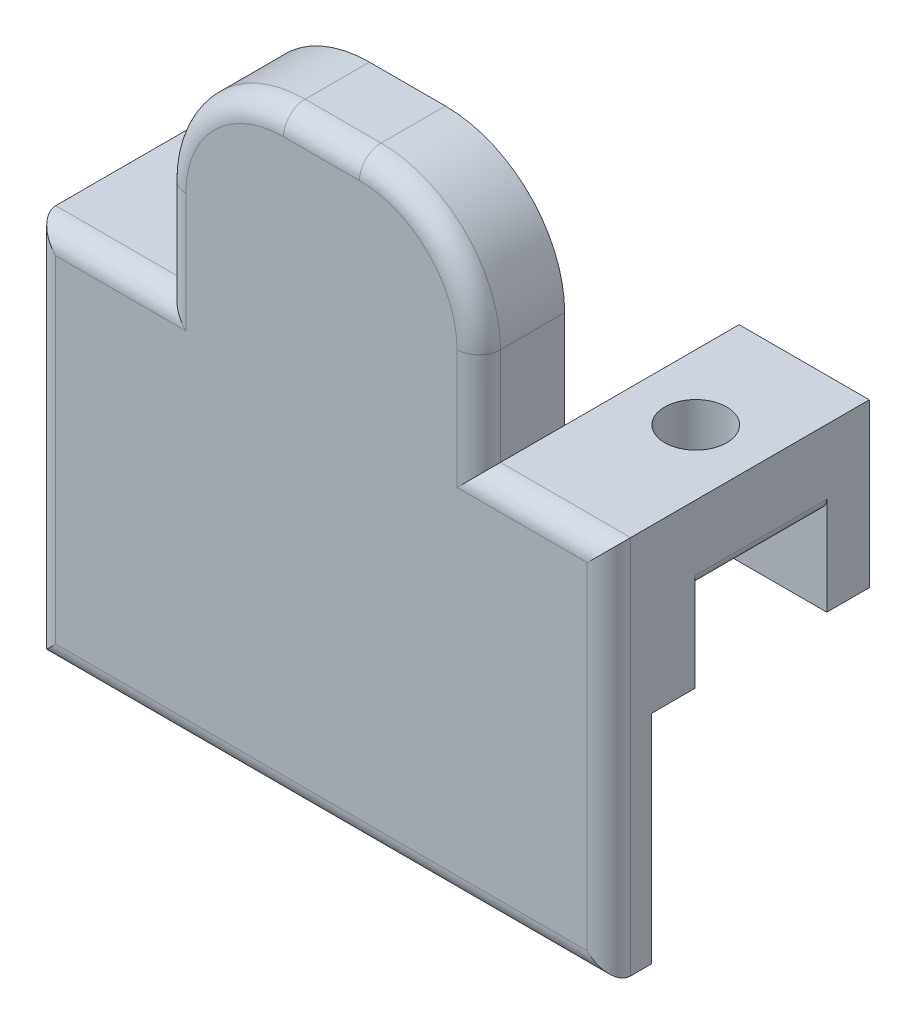
from build123d import *

# Parameters (mm, degrees)
SKETCH_1_W           = 53
SKETCH_1_H           = 35
EXTRUDE_1_DEPTH      = 3.92
SKETCH_2_W           = 12
SKETCH_2_H           = 27
CUT_EXTRUDE_1_DEPTH  = 4
EXTRUDE_2_DEPTH      = 16.08
EXTRUDE_2_DEPTH_BACK = 3.92
SKETCH_3_W           = 12
SKETCH_3_H           = 7
SKETCH_4_W           = 12
SKETCH_4_H           = 3.92
EXTRUDE_3_DEPTH      = 8
SKETCH_5_R           = 2.86
CUT_EXTRUDE_2_DEPTH  = 37.889245045
SKETCH_6_R           = 6
CUT_EXTRUDE_3_DEPTH  = 4
EXTRUDE_4_DEPTH      = 4
SKETCH_8_W           = 53
SKETCH_8_H           = 3.92
EXTRUDE_5_DEPTH      = 20
FILLET_1_R           = 2.5
FILLET_2_R           = 11
FILLET_3_R           = 1
FILLET_4_R           = 2


with BuildPart() as part:
    # 스케치1 → 보스-돌출1 (new body)
    with BuildSketch(Plane.XY):
        Rectangle(SKETCH_1_W, SKETCH_1_H)
    extrude(amount=EXTRUDE_1_DEPTH)

    # 스케치2 → 컷-돌출1 (cut)
    with BuildSketch(Plane.XY.offset(3.92)):
        with Locations((-20.5, 4)):
            Rectangle(SKETCH_2_W, SKETCH_2_H)
        with Locations((20.5, 4)):
            Rectangle(SKETCH_2_W, SKETCH_2_H)
    extrude(amount=-CUT_EXTRUDE_1_DEPTH, mode=Mode.SUBTRACT)

    # 스케치3 → 보스-돌출2 (add, two sides: drawn at the far end of the back side and taken through both)
    with BuildSketch(Plane(origin=(0, 0, 0), x_dir=(-1, 0, 0), z_dir=(0, 0, -1)).offset(-EXTRUDE_2_DEPTH_BACK)):
        with Locations((-20.5, -6)):
            Rectangle(SKETCH_3_W, SKETCH_3_H)
        with Locations((20.5, -6)):
            Rectangle(SKETCH_3_W, SKETCH_3_H)
    extrude(amount=EXTRUDE_2_DEPTH + EXTRUDE_2_DEPTH_BACK)

    # 스케치4 → 보스-돌출3 (add)
    with BuildSketch(Plane.XZ.offset(9.5)):
        with Locations((-20.5, -14.12)):
            Rectangle(SKETCH_4_W, SKETCH_4_H)
        with Locations((20.5, -14.12)):
            Rectangle(SKETCH_4_W, SKETCH_4_H)
    extrude(amount=EXTRUDE_3_DEPTH)

    # 스케치5 → 컷-돌출2 (cut, through all)
    with BuildSketch(Plane(origin=(0, -2.5, 0), x_dir=(1, 0, 0), z_dir=(0, 1, 0))):
        with Locations(Location((-20.5, 6.08, 0), (0, 0, 180))):
            Circle(SKETCH_5_R)
        with Locations((20.5, 6.08)):
            Circle(SKETCH_5_R)
    extrude(amount=-CUT_EXTRUDE_2_DEPTH, mode=Mode.SUBTRACT)

    # 스케치6 → 컷-돌출3 (cut)
    with BuildSketch(Plane.XY.offset(3.92)):
        with Locations((0, 2.5)):
            Circle(SKETCH_6_R)
    extrude(amount=-CUT_EXTRUDE_3_DEPTH, mode=Mode.SUBTRACT)

    # 스케치7 → 보스-돌출4 (add)
    with BuildSketch(Plane.XY.offset(3.92)):
        Polygon((-14.5, -2.5), (-26.5, -2.5), (-26.5, -17.5), (26.5, -17.5), (26.5, -2.5), (14.5, -2.5), (14.5, 17.5), (-14.5, 17.5), align=None)
    extrude(amount=EXTRUDE_4_DEPTH)

    # 스케치8 → 보스-돌출5 (add)
    with BuildSketch(Plane.XZ.offset(17.5)):
        with Locations((0, 5.96)):
            Rectangle(SKETCH_8_W, SKETCH_8_H)
    extrude(amount=EXTRUDE_5_DEPTH)

    # 필렛1
    fillet_1_edges = [part.edges().sort_by_distance(p)[0] for p in [
        (14.5, -9.5, -6.08),
        (-14.5, -9.5, -6.08),
    ]]
    fillet(fillet_1_edges, radius=FILLET_1_R)

    # 필렛2
    fillet_2_edges = [part.edges().sort_by_distance(p)[0] for p in [
        (-14.5, 17.5, 3.96),
        (14.5, 17.5, 3.96),
    ]]
    fillet(fillet_2_edges, radius=FILLET_2_R)

    # 필렛3
    fillet_3_edges = [part.edges().sort_by_distance(p)[0] for p in [
        (26.5, -9.5, -6.08),
        (-26.5, -9.5, -6.08),
    ]]
    fillet(fillet_3_edges, radius=FILLET_3_R)

    # 필렛4
    fillet_4_edges = [part.edges().sort_by_distance(p)[0] for p in [
        (-20.5, -2.5, 7.92),
        (-26.5, -20, 7.92),
        (26.5, -20, 7.92),
        (20.5, -2.5, 7.92),
        (14.5, 2, 7.92),
        (0, -37.5, 7.92),
        (-14.5, 2, 7.92),
        (0, 17.5, 7.92),
        (-11.278174593, 14.278174593, 7.92),
        (11.278174593, 14.278174593, 7.92),
    ]]
    fillet(fillet_4_edges, radius=FILLET_4_R)


solid = part.part
